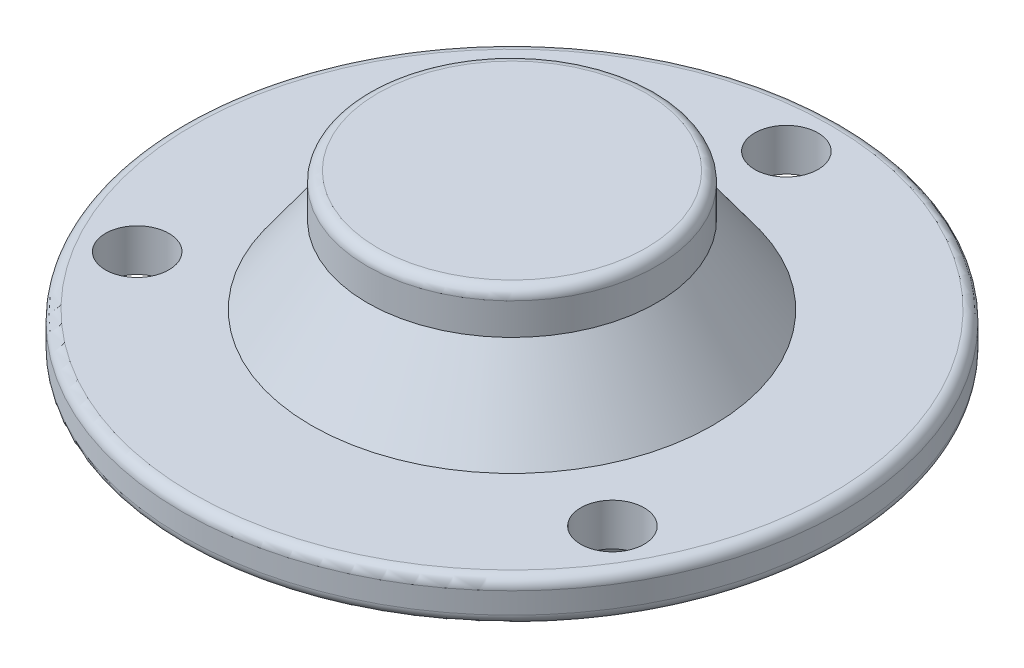
from build123d import *

# Parameters (mm, degrees)
CONG_1_R                = 0.5
ESQUISSE2_R             = 1.5
ENL_V_MAT_EXTRU_1_DEPTH = 10


with BuildPart() as part:
    # Esquisse1 → Révolution1 (revolve)
    with BuildSketch(Plane.XY, mode=Mode.PRIVATE) as r_volution1_sk:
        with BuildLine():
            Line((0, 5.7), (6.85, 5.7))
            Line((6.85, 5.7), (6.85, 3.7))
            Line((6.85, 3.7), (9.5, 0))
            Line((9.5, 0), (15.6, 0))
            Line((15.6, 0), (15.6, -2))
            Line((15.6, -2), (10, -2))
            ThreePointArc((10, -2), (8.212627426, -6.045887094), (4.880340938, -8.954455446))
            ThreePointArc((4.880340938, -8.954455446), (2.707365275, -10.683176126), (0, -11.3))
            Line((0, -11.3), (0, 5.7))
        make_face()
    revolve(r_volution1_sk.sketch.rotate(Axis((0, 5.7, 0), (0, -1, 0)), 90), axis=Axis((0, 5.7, 0), (0, -1, 0)))

    # Congé1
    cong_1_edges = [part.edges().sort_by_distance(p)[0] for p in [
        (0, 5.7, -6.85),
        (0, 0, -15.6),
        (0, -2, -15.6),
    ]]
    fillet(cong_1_edges, radius=CONG_1_R)

    # Esquisse2 → Enlèv. mat.-Extru.1 (cut)
    with BuildSketch(Plane(origin=(0, 0, 0), x_dir=(1, 0, 0), z_dir=(0, 1, 0))):
        with Locations(Location((0, 12.990381057, 0), (0, 0, 270))):
            Circle(ESQUISSE2_R)
        with Locations(Location((11.25, -6.495190528, 0), (0, 0, 270))):
            Circle(ESQUISSE2_R)
        with Locations(Location((-11.25, -6.495190528, 0), (0, 0, 270))):
            Circle(ESQUISSE2_R)
    extrude(amount=-ENL_V_MAT_EXTRU_1_DEPTH, mode=Mode.SUBTRACT)


solid = part.part
